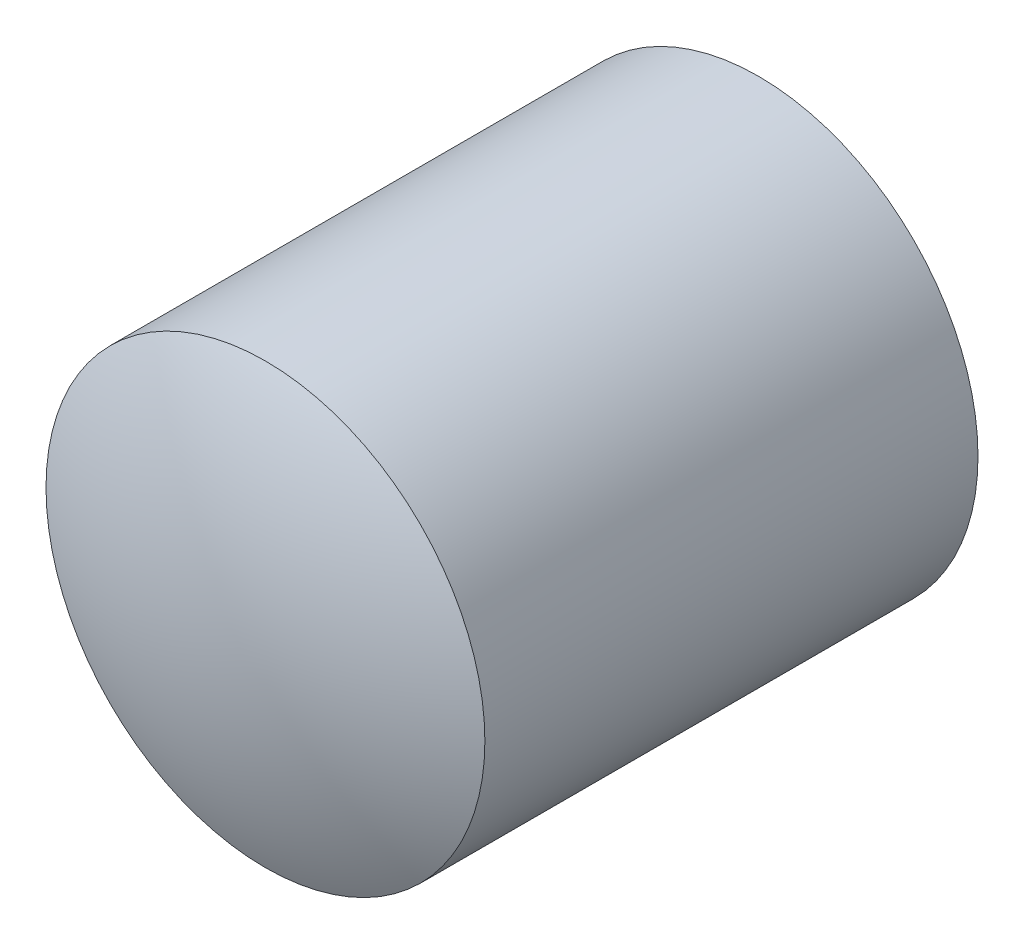
from build123d import *


with BuildPart() as part:
    # Sketch3 → Revolve1 (revolve)
    with BuildSketch(Plane(origin=(0, 0, 0), x_dir=(0, 0, -1), z_dir=(1, 0, 0))):
        with BuildLine():
            Line((0, 2.717508), (0, 0))
            Line((0, 0), (3.672125755, 0))
            ThreePointArc((3.672125755, 0), (3.515457352, 1.393541103), (3.053274, 2.717508))
            Line((3.053274, 2.717508), (0, 2.717508))
        make_face()
        with BuildLine():
            ThreePointArc((-3.053274, 2.717508), (-3.515457352, 1.393541103), (-3.672125755, 0))
            Line((-3.672125755, 0), (-2.603874245, 0))
            Line((-2.603874245, 0), (0, 0))
            Line((0, 0), (0, 2.717508))
            Line((0, 2.717508), (-3.053274, 2.717508))
        make_face()
    revolve(axis=Axis((0, 0, 0), (0, 0, 1)))


solid = part.part
